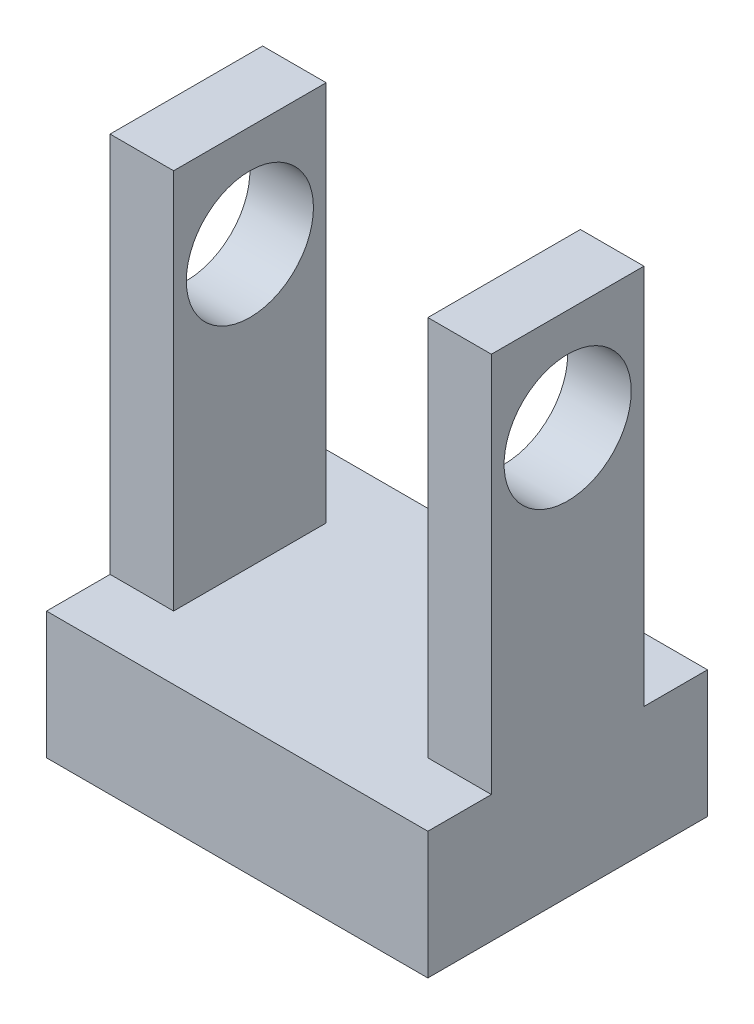
from build123d import *

# Parameters (mm, degrees)
SKETCH1_W           = 30
SKETCH1_H           = 22
BOSS_EXTRUDE1_DEPTH = 10
SKETCH1_4_W         = 5
SKETCH1_4_H         = 12
BOSS_EXTRUDE2_DEPTH = 40
SKETCH2_R           = 5
CUT_EXTRUDE1_DEPTH  = 40


with BuildPart() as part:
    # Sketch1 → Boss-Extrude1 (new body)
    with BuildSketch(Plane(origin=(0, 0, 0), x_dir=(1, 0, 0), z_dir=(0, 1, 0))):
        with Locations((-50.637562945, -40.26337684)):
            Rectangle(SKETCH1_W, SKETCH1_H)
    extrude(amount=BOSS_EXTRUDE1_DEPTH)

    # Sketch1<4> → Boss-Extrude2 (add)
    with BuildSketch(Plane(origin=(0, 0, 0), x_dir=(1, 0, 0), z_dir=(0, 1, 0))):
        with Locations((-63.137562945, -40.26337684)):
            Rectangle(SKETCH1_4_W, SKETCH1_4_H)
        with Locations((-38.137562945, -40.26337684)):
            Rectangle(SKETCH1_4_W, SKETCH1_4_H)
    extrude(amount=BOSS_EXTRUDE2_DEPTH)

    # Sketch2 → Cut-Extrude1 (cut)
    with BuildSketch(Plane.ZY.offset(65.637562945)):
        with Locations((40.26337684, 32)):
            Circle(SKETCH2_R)
    extrude(amount=-CUT_EXTRUDE1_DEPTH, mode=Mode.SUBTRACT)


solid = part.part
